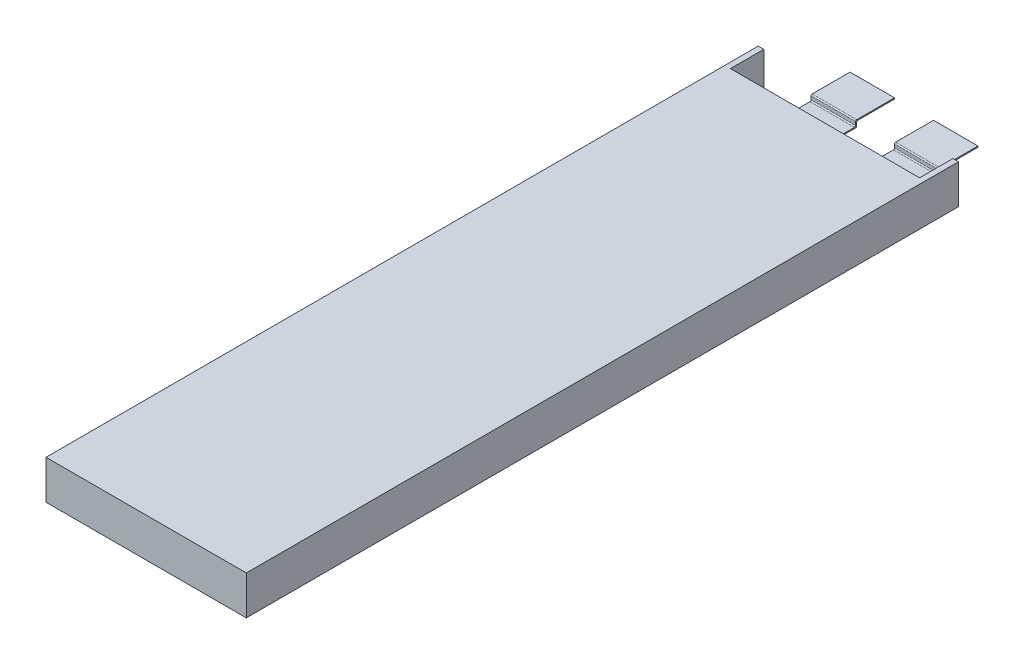
from build123d import *

# Parameters (mm, degrees)
SKETCH1_W           = 36
SKETCH1_H           = 128
BOSS_EXTRUDE1_DEPTH = 1
SKETCH2_W           = 36
SKETCH2_H           = 122
BOSS_EXTRUDE2_DEPTH = 6
SKETCH3_W           = 1
SKETCH3_H           = 6
BOSS_EXTRUDE3_DEPTH = 6
BOSS_EXTRUDE4_START = 3.5
BOSS_EXTRUDE4_DEPTH = 8


with BuildPart() as part:
    # Sketch1 → Boss-Extrude1 (new body)
    with BuildSketch(Plane(origin=(0, 0, 0), x_dir=(1, 0, 0), z_dir=(0, 1, 0))):
        Rectangle(SKETCH1_W, SKETCH1_H)
    extrude(amount=BOSS_EXTRUDE1_DEPTH)

    # Sketch2 → Boss-Extrude2 (add)
    with BuildSketch(Plane(origin=(0, 1, 0), x_dir=(1, 0, 0), z_dir=(0, 1, 0))):
        with Locations((0, -3)):
            Rectangle(SKETCH2_W, SKETCH2_H)
    extrude(amount=BOSS_EXTRUDE2_DEPTH)

    # Sketch3 → Boss-Extrude3 (add)
    with BuildSketch(Plane(origin=(0, 1, 0), x_dir=(1, 0, 0), z_dir=(0, 1, 0))):
        with Locations((-17.5, 61)):
            Rectangle(SKETCH3_W, SKETCH3_H)
    boss_extrude3 = extrude(amount=BOSS_EXTRUDE3_DEPTH)

    # Sketch4 → Boss-Extrude4 (add)
    with BuildSketch(Plane(origin=(0, 0, 0), x_dir=(0, 0, -1), z_dir=(1, 0, 0)).offset(BOSS_EXTRUDE4_START)):
        with BuildLine():
            Line((67.2, 1.2), (74, 1.2))
            Line((74, 1.2), (74, 1))
            Line((74, 1), (67.4, 1))
            ThreePointArc((67.4, 1), (67.258578644, 0.941421356), (67.2, 0.8))
            Line((67.2, 0.8), (67.2, 0.2))
            ThreePointArc((67.2, 0.2), (67.141421356, 0.058578644), (67, 0))
            Line((67, 0), (64, 0))
            Line((64, 0), (64, 0.2))
            Line((64, 0.2), (66.8, 0.2))
            ThreePointArc((66.8, 0.2), (66.941421356, 0.258578644), (67, 0.4))
            Line((67, 0.4), (67, 1))
            ThreePointArc((67, 1), (67.058578644, 1.141421356), (67.2, 1.2))
        make_face()
    boss_extrude4 = extrude(amount=BOSS_EXTRUDE4_DEPTH)

    # Mirror1: Boss-Extrude3, Boss-Extrude4 across plane
    add(boss_extrude3.mirror(Plane(origin=(0, 0, 0), x_dir=(0, 0, 1), z_dir=(1, 0, 0))))
    add(boss_extrude4.mirror(Plane(origin=(0, 0, 0), x_dir=(0, 0, 1), z_dir=(1, 0, 0))))


solid = part.part
